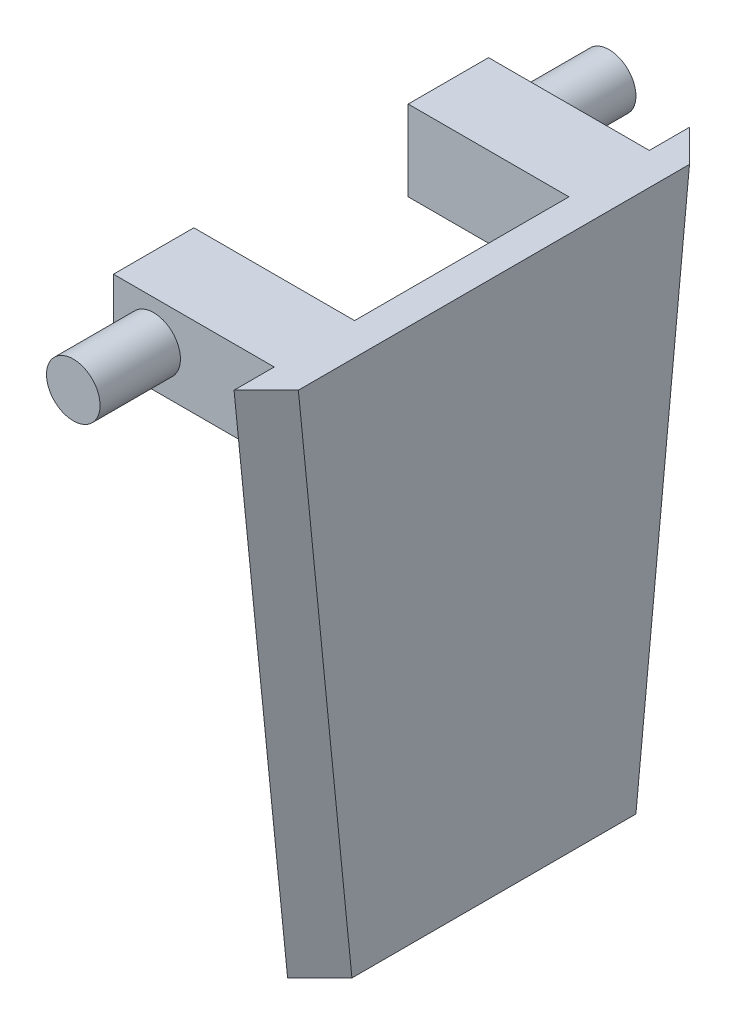
from build123d import *

# Parameters (mm, degrees)
SALIENTE_EXTRUIR1_DEPTH = 6
CROQUIS3_W              = 15
CROQUIS3_H              = 15
SALIENTE_EXTRUIR2_DEPTH = 30
CROQUIS4_R              = 5
SALIENTE_EXTRUIR3_DEPTH = 15


with BuildPart() as part:
    # Croquis1 → Saliente-Extruir1 (new body)
    with BuildSketch(Plane(origin=(0, 0, 0), x_dir=(0, 0, -1), z_dir=(1, 0, 0))):
        Polygon((32.5, 0), (-32.5, 0), (-42.5, 100), (42.5, 100), align=None)
    extrude(amount=SALIENTE_EXTRUIR1_DEPTH)

    # Croquis3 → Saliente-Extruir2 (add)
    with BuildSketch(Plane.ZY):
        with Locations((-27.5, 92.5)):
            Rectangle(CROQUIS3_W, CROQUIS3_H)
        with Locations((27.5, 92.5)):
            Rectangle(CROQUIS3_W, CROQUIS3_H)
    extrude(amount=SALIENTE_EXTRUIR2_DEPTH)

    # Croquis4 → Saliente-Extruir3 (add)
    with BuildSketch(Plane(origin=(0, 0, -35), x_dir=(-1, 0, 0), z_dir=(0, 0, -1))):
        with Locations(Location((22.5, 92.538258804, 0), (0, 0, 270))):
            Circle(CROQUIS4_R)
    saliente_extruir3 = extrude(amount=SALIENTE_EXTRUIR3_DEPTH)

    # Simetría1: Saliente-Extruir3 across plane
    add(saliente_extruir3.mirror(Plane.XY))

    # Cortar-Barrer1: sweep along a curve in space
    with BuildLine() as cortar_barrer1_path:
        Line((6, 100, 42.5), (6, 0, 32.5))
    # Croquis7 → Cortar-Barrer1 (sweep, cut)
    with BuildSketch(Plane(origin=(0, 100, 0), x_dir=(1, 0, 0), z_dir=(0, 1, 0))):
        Polygon((0, -42.5), (6, -36.5), (6, -42.5), align=None)
    sweep(path=cortar_barrer1_path.line, mode=Mode.SUBTRACT)

    # Cortar-Barrer2: sweep along a curve in space
    with BuildLine() as cortar_barrer2_path:
        Line((6, 0, -32.5), (6, 100, -42.5))
    # Croquis8 → Cortar-Barrer2 (sweep, cut)
    with BuildSketch(Plane(origin=(0, 100, 0), x_dir=(1, 0, 0), z_dir=(0, 1, 0))):
        Polygon((0, 42.5), (6, 36.5), (6, 42.5), align=None)
    sweep(path=cortar_barrer2_path.line, mode=Mode.SUBTRACT)


solid = part.part
